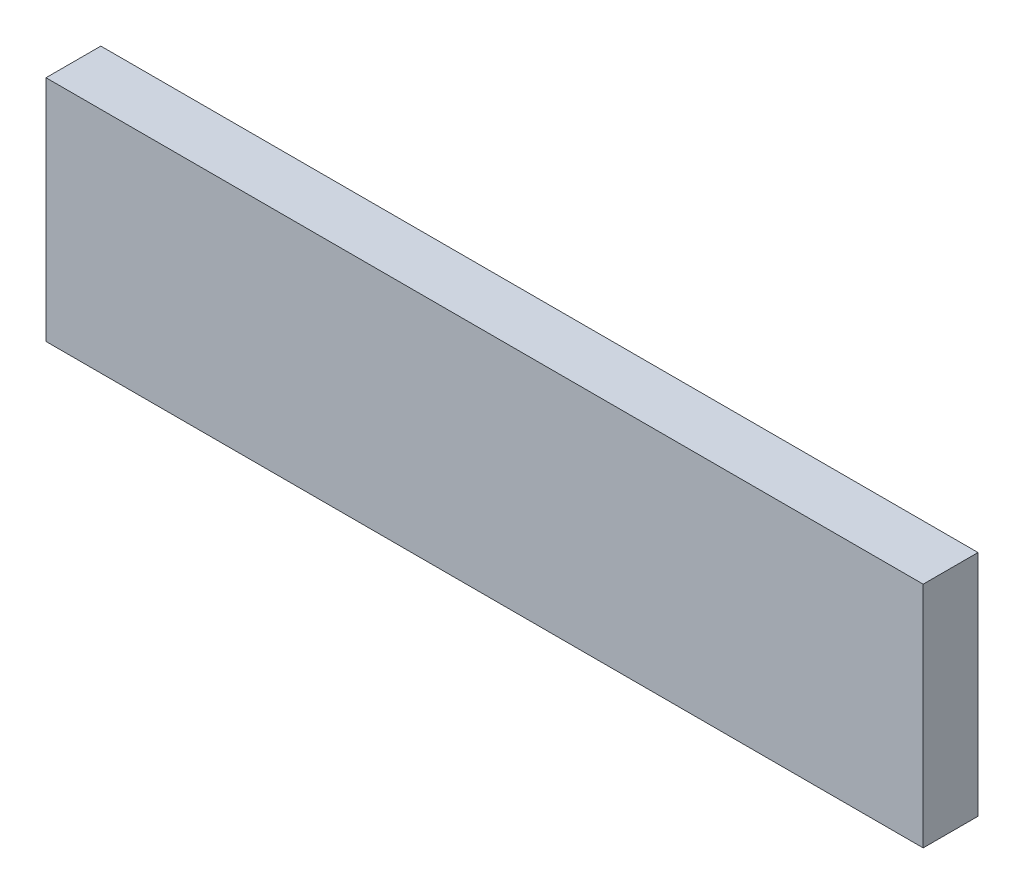
from build123d import *

# Parameters (mm, degrees)
ESBO_O1_W                = 192
ESBO_O1_H                = 50
RESSALTO_EXTRUS_O1_DEPTH = 6
ESBO_O2_R                = 1.5
CORTE_EXTRUS_O1_DEPTH    = 15


with BuildPart() as part:
    # Esboço1 → Ressalto-extrusão1 (new, symmetric)
    with BuildSketch(Plane.XY):
        Rectangle(ESBO_O1_W, ESBO_O1_H)
    extrude(amount=RESSALTO_EXTRUS_O1_DEPTH, both=True)

    # Esboço2 → Corte-extrusão1 (cut, symmetric)
    with BuildSketch(Plane(origin=(0, -25, 0), x_dir=(-1, 0, 0), z_dir=(0, -1, 0))):
        with Locations(Location((77.5, 0, 0), (0, 0, 90))):
            Circle(ESBO_O2_R)
        with Locations(Location((-77.5, 0, 0), (0, 0, 90))):
            Circle(ESBO_O2_R)
    extrude(amount=CORTE_EXTRUS_O1_DEPTH, both=True, mode=Mode.SUBTRACT)


solid = part.part
